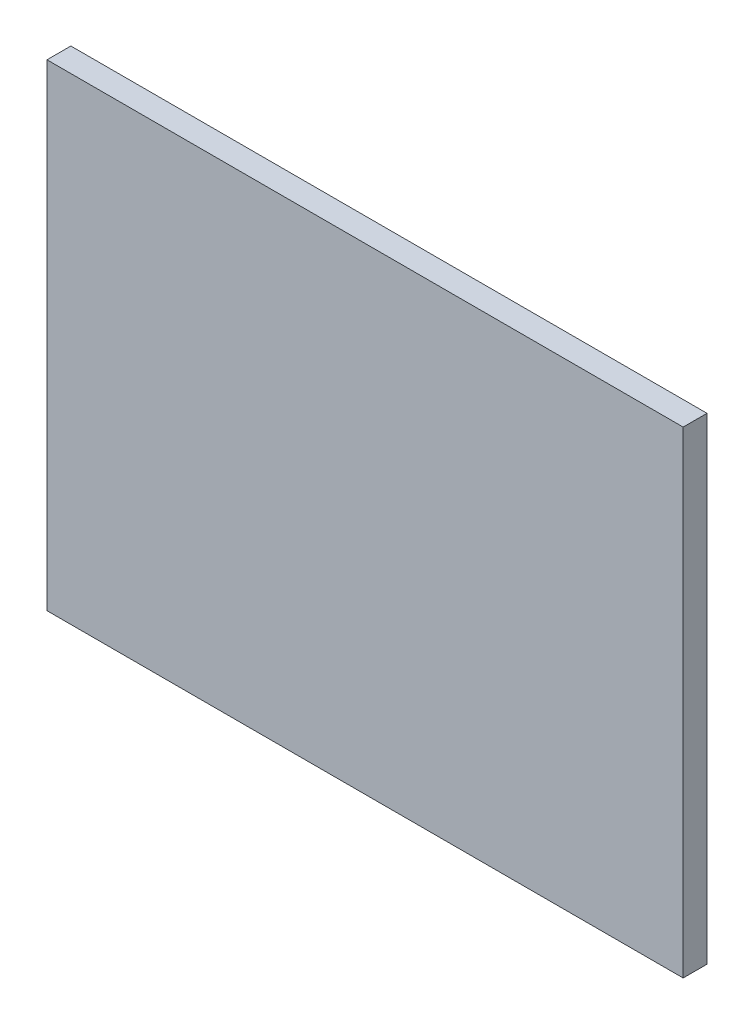
from build123d import *

# Parameters (mm, degrees)
ESQUISSE1_W        = 80
ESQUISSE1_H        = 60
BOSS_EXTRU_1_DEPTH = 3


with BuildPart() as part:
    # Esquisse1 → Boss.-Extru.1 (new body)
    with BuildSketch(Plane.XY):
        with Locations((-27.018725274, 14.651797813)):
            Rectangle(ESQUISSE1_W, ESQUISSE1_H)
    extrude(amount=BOSS_EXTRU_1_DEPTH)


solid = part.part
